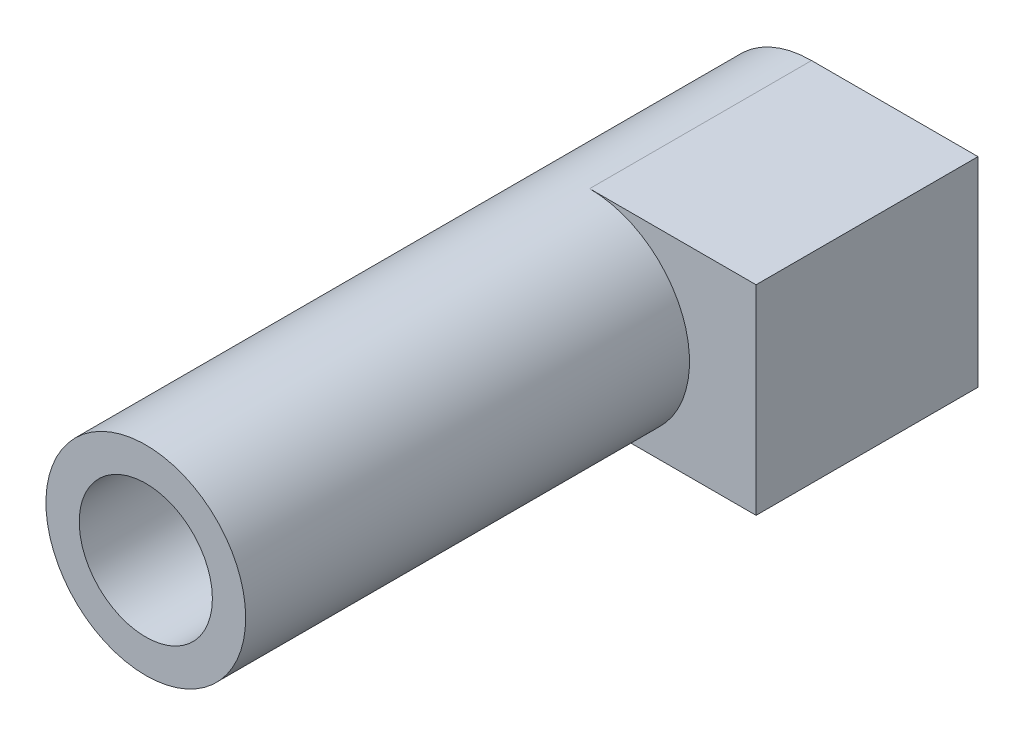
from build123d import *

# Parameters (mm, degrees)
ESQUISSE1_R        = 6
BOSS_EXTRU_1_DEPTH = 20
ESQUISSE1_3_R      = 6
BOSS_EXTRU_2_DEPTH = 60


with BuildPart() as part:
    # Esquisse1 → Boss.-Extru.1 (new body)
    with BuildSketch(Plane.XY):
        with BuildLine():
            Line((15, 9), (0, 9))
            ThreePointArc((0, 9), (-9, 0), (0, -9))
            Line((0, -9), (15, -9))
            Line((15, -9), (15, 9))
        make_face()
        Circle(ESQUISSE1_R, mode=Mode.SUBTRACT)
    extrude(amount=BOSS_EXTRU_1_DEPTH)

    # Esquisse1<3> → Boss.-Extru.2 (add)
    with BuildSketch(Plane.XY):
        with BuildLine():
            ThreePointArc((9, 0), (6.363961031, 6.363961031), (0, 9))
            ThreePointArc((0, 9), (-9, 0), (0, -9))
            ThreePointArc((0, -9), (6.363961031, -6.363961031), (9, 0))
        make_face()
        Circle(ESQUISSE1_3_R, mode=Mode.SUBTRACT)
    extrude(amount=BOSS_EXTRU_2_DEPTH)


solid = part.part
